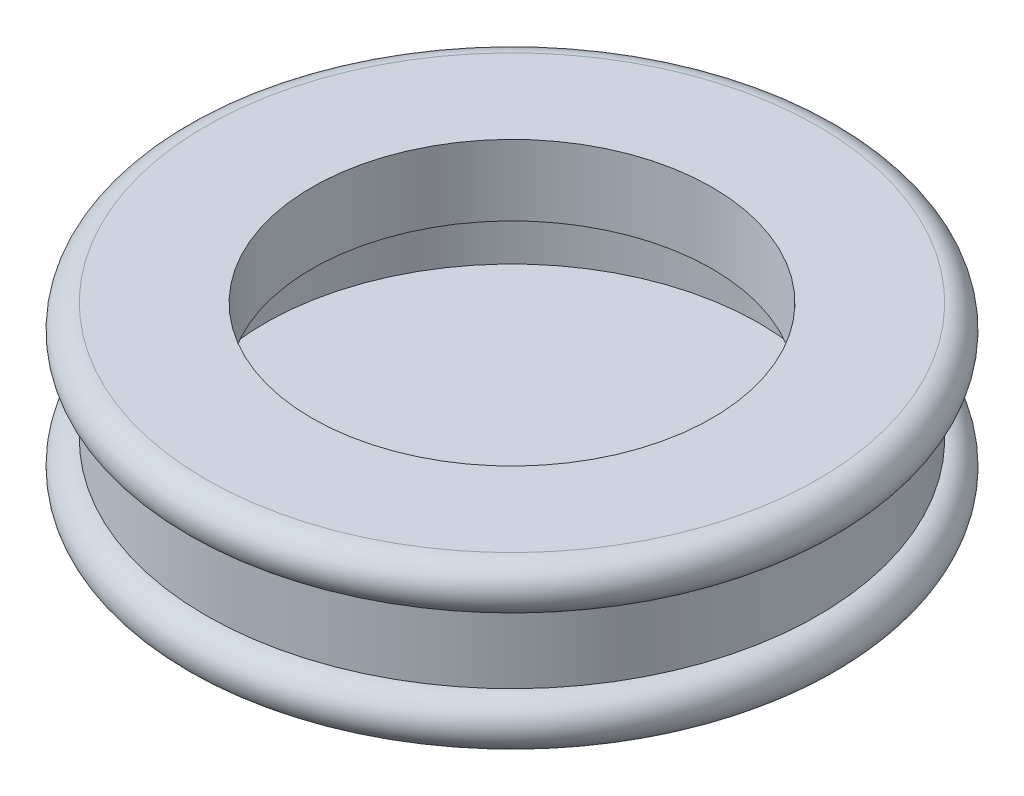
from build123d import *


with BuildPart() as part:
    # Skizze1 → Rotation1 (revolve)
    with BuildSketch(Plane.XY, mode=Mode.PRIVATE) as rotation1_sk:
        with BuildLine():
            Line((0, 0), (13.150358125, 2))
            ThreePointArc((13.150358125, 2), (13.997153849, 3.064025241), (13, 3.988631597))
            Line((13, 3.988631597), (13, 6.998384988))
            ThreePointArc((13, 6.998384988), (14, 7.998384988), (13, 8.998384988))
            Line((13, 8.998384988), (8.5, 8.998384988))
            Line((8.5, 8.998384988), (8.5, 5.998384988))
            Line((8.5, 5.998384988), (10.5, 5.998384988))
            Line((10.5, 5.998384988), (10.5, 2.998384988))
            Line((10.5, 2.998384988), (0, 2.998384988))
            Line((0, 2.998384988), (0, 0))
        make_face()
    revolve(rotation1_sk.sketch.rotate(Axis((0, 0, 0), (0, 1, 0)), 90), axis=Axis((0, 0, 0), (0, 1, 0)))


solid = part.part
